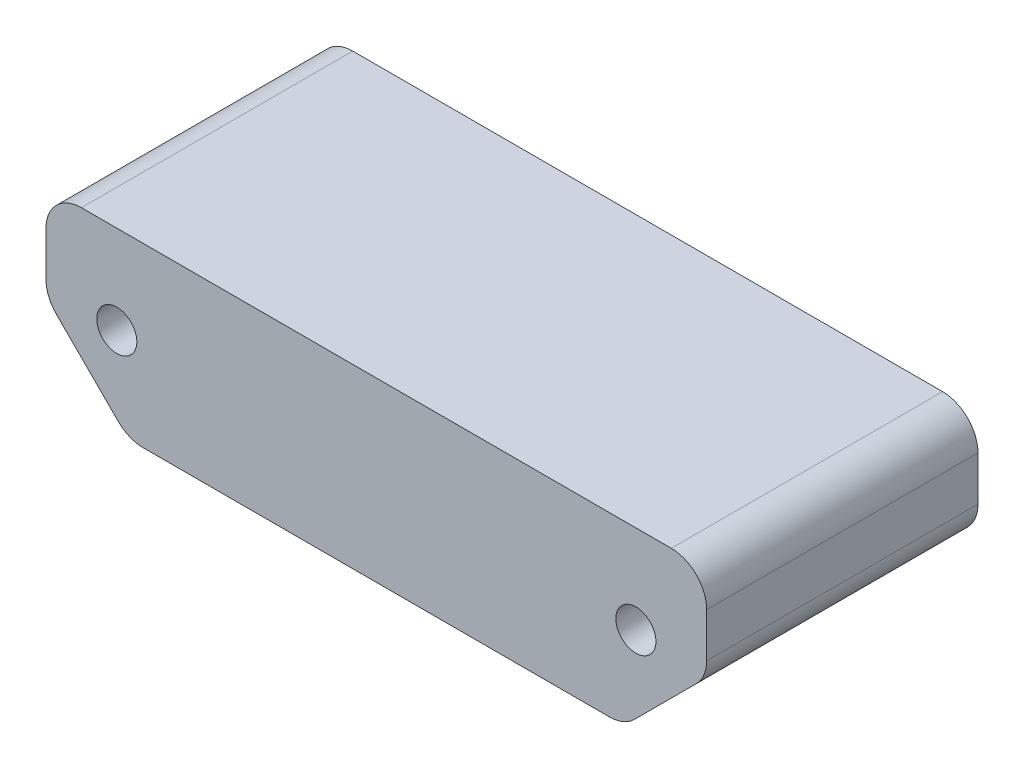
from build123d import *

# Parameters (mm, degrees)
SKETCH_1_W      = 56
SKETCH_1_H      = 15
SKETCH_1_R      = 1.7
EXTRUDE_1_DEPTH = 23
CHAMFER_2_SIZE  = 7
FILLET_1_R      = 3


with BuildPart() as part:
    # 草图1 → 凸台-拉伸1 (new body)
    with BuildSketch(Plane.XY):
        Rectangle(SKETCH_1_W, SKETCH_1_H)
        with Locations((22, 0)):
            Circle(SKETCH_1_R, mode=Mode.SUBTRACT)
        with Locations((-22, 0)):
            Circle(SKETCH_1_R, mode=Mode.SUBTRACT)
    extrude(amount=EXTRUDE_1_DEPTH)

    # 倒角2
    chamfer_2_edges = [part.edges().sort_by_distance(p)[0] for p in [
        (28, -7.5, 11.5),
        (-28, -7.5, 11.5),
    ]]
    chamfer(chamfer_2_edges, length=CHAMFER_2_SIZE)

    # 圆角1
    fillet_1_edges = [part.edges().sort_by_distance(p)[0] for p in [
        (28, -0.5, 11.5),
        (-21, -7.5, 11.5),
        (21, -7.5, 11.5),
        (-28, -0.5, 11.5),
        (-28, 7.5, 11.5),
        (28, 7.5, 11.5),
    ]]
    fillet(fillet_1_edges, radius=FILLET_1_R)


solid = part.part
